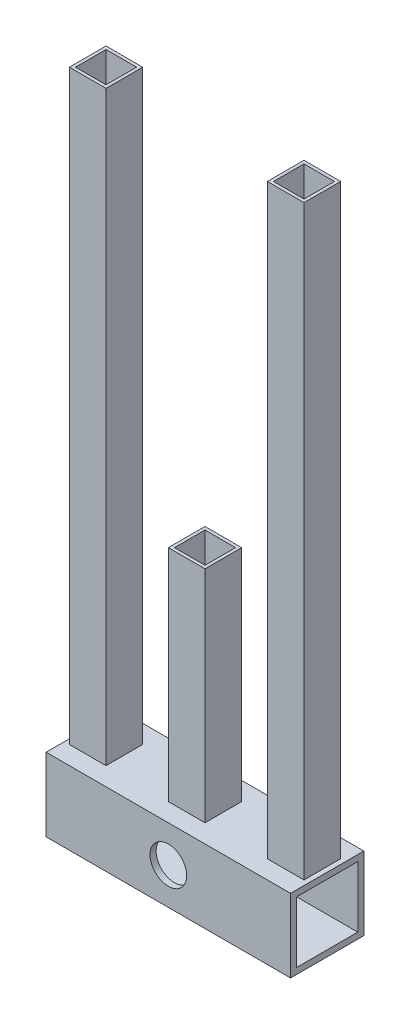
from build123d import *

# Parameters (mm, degrees)
SKETCH1_W           = 38.1
SKETCH1_H           = 38.1
SKETCH1_W_2         = 31.75
SKETCH1_H_2         = 31.75
BOSS_EXTRUDE1_DEPTH = 127
SKETCH2_W           = 19.05
SKETCH2_H           = 19.05
SKETCH2_W_2         = 15.875
SKETCH2_H_2         = 15.875
BOSS_EXTRUDE2_DEPTH = 114.3
SKETCH3_W           = 19.05
SKETCH3_H           = 19.05
SKETCH3_W_2         = 15.875
SKETCH3_H_2         = 15.875
BOSS_EXTRUDE3_DEPTH = 304.8
SKETCH4_R           = 9.525
CUT_EXTRUDE1_DEPTH  = 350.94204163


with BuildPart() as part:
    # Sketch1 → Boss-Extrude1 (new body)
    with BuildSketch(Plane(origin=(0, 0, 0), x_dir=(0, 0, -1), z_dir=(1, 0, 0))):
        Rectangle(SKETCH1_W, SKETCH1_H)
        Rectangle(SKETCH1_W_2, SKETCH1_H_2, mode=Mode.SUBTRACT)
    extrude(amount=BOSS_EXTRUDE1_DEPTH)

    # Sketch2 → Boss-Extrude2 (add)
    with BuildSketch(Plane(origin=(0, 19.05, 0), x_dir=(1, 0, 0), z_dir=(0, 1, 0))):
        with Locations((63.5, 0)):
            Rectangle(SKETCH2_W, SKETCH2_H)
        with Locations((63.5, 0)):
            Rectangle(SKETCH2_W_2, SKETCH2_H_2, mode=Mode.SUBTRACT)
    extrude(amount=BOSS_EXTRUDE2_DEPTH)

    # Sketch3 → Boss-Extrude3 (add)
    with BuildSketch(Plane(origin=(0, 19.05, 0), x_dir=(1, 0, 0), z_dir=(0, 1, 0))):
        with Locations((12.065, 0)):
            Rectangle(SKETCH3_W, SKETCH3_H)
        with Locations((12.065, 0)):
            Rectangle(SKETCH3_W_2, SKETCH3_H_2, mode=Mode.SUBTRACT)
    boss_extrude3 = extrude(amount=BOSS_EXTRUDE3_DEPTH)

    # Mirror1: Boss-Extrude3 across plane
    add(boss_extrude3.mirror(Plane.ZY.offset(-63.5)))

    # Sketch4 → Cut-Extrude1 (cut, through all)
    with BuildSketch(Plane.XY.offset(19.05)):
        with Locations((63.5, 0)):
            Circle(SKETCH4_R)
    extrude(amount=-CUT_EXTRUDE1_DEPTH, mode=Mode.SUBTRACT)


solid = part.part
